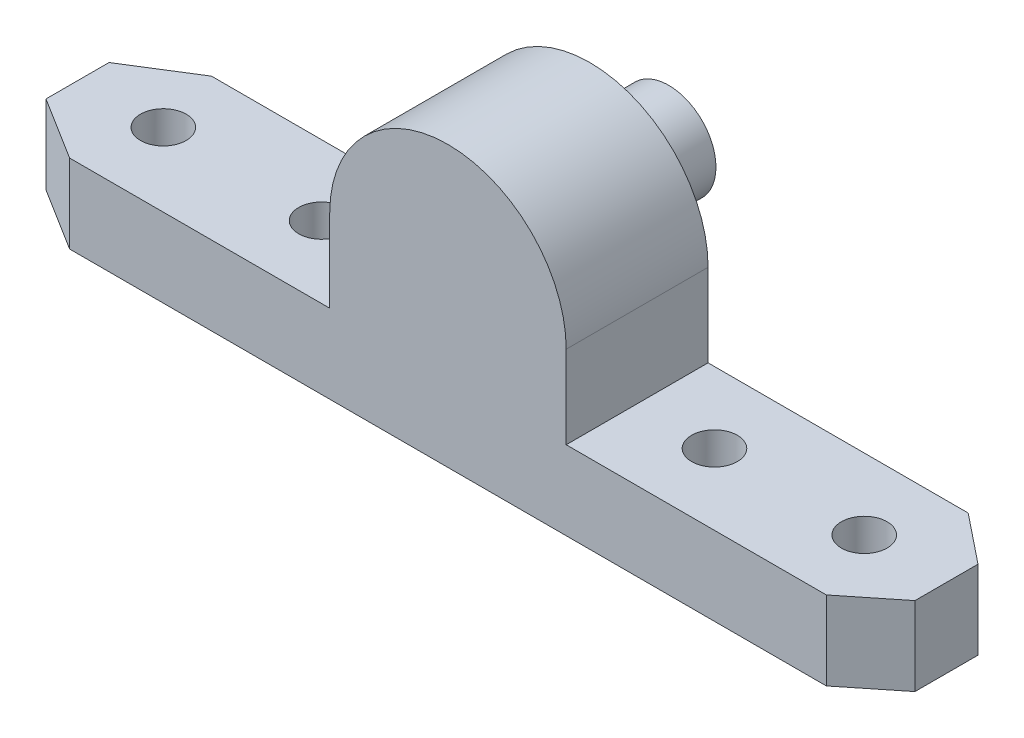
from build123d import *

# Parameters (mm, degrees)
DODANIE_WYCI_GNI_CIE1_DEPTH = 5
DODANIE_WYCI_GNI_CIE2_DEPTH = 9
SZKIC4_R                    = 1.45
WYTNIJ_WYCI_GNI_CIE1_DEPTH  = 6
SZKIC3_R                    = 3
DODANIE_WYCI_GNI_CIE3_DEPTH = 14


with BuildPart() as part:
    # Szkic1 → Dodanie-wyciągnięcie1 (new body)
    with BuildSketch(Plane(origin=(0, 0, 0), x_dir=(1, 0, 0), z_dir=(0, 1, 0))):
        Polygon((24, 4.5), (27.122498999, 2), (27.122498999, -2), (24, -4.5), (-24, -4.5), (-28, -2), (-28, 2), (-24, 4.5), align=None)
    extrude(amount=DODANIE_WYCI_GNI_CIE1_DEPTH)

    # Szkic2 → Dodanie-wyciągnięcie2 (add)
    with BuildSketch(Plane.XY.offset(4.5)):
        with BuildLine():
            Line((-7.5, 5), (7.5, 5))
            Line((7.5, 5), (7.5, 10.25))
            ThreePointArc((7.5, 10.25), (0, 17.75), (-7.5, 10.25))
            Line((-7.5, 10.25), (-7.5, 5))
        make_face()
    extrude(amount=-DODANIE_WYCI_GNI_CIE2_DEPTH)

    # Szkic4 → Wytnij-wyciągnięcie1 (cut)
    with BuildSketch(Plane(origin=(0, 5, 0), x_dir=(1, 0, 0), z_dir=(0, 1, 0))):
        with Locations(Location((12.40562475, 0, 0), (0, 0, 270))):
            Circle(SZKIC4_R)
        with Locations(Location((21.90562475, 0, 0), (0, 0, 270))):
            Circle(SZKIC4_R)
        with Locations(Location((-12.57201541, 0.053033314, 0), (0, 0, 270))):
            Circle(SZKIC4_R)
        with Locations(Location((-22.71604623, 0.159099943, 0), (0, 0, 270))):
            Circle(SZKIC4_R)
    extrude(amount=-WYTNIJ_WYCI_GNI_CIE1_DEPTH, mode=Mode.SUBTRACT)

    # Szkic3 → Dodanie-wyciągnięcie3 (add)
    with BuildSketch(Plane.XY.offset(4.5)):
        with Locations((0, 11)):
            Circle(SZKIC3_R)
    extrude(amount=-DODANIE_WYCI_GNI_CIE3_DEPTH)


solid = part.part
